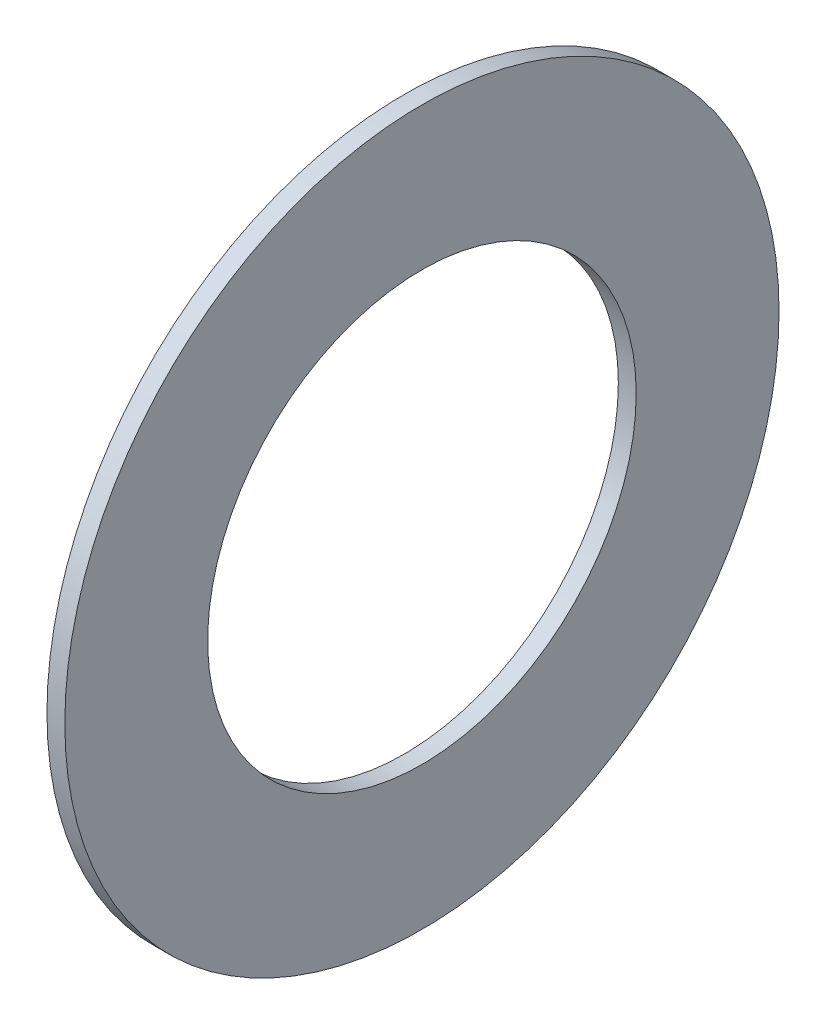
from build123d import *

# Parameters (mm, degrees)
SKETCH1_R      = 15.875
SKETCH1_R_2    = 9.525
EXTRUDE1_DEPTH = 0.79375


with BuildPart() as part:
    # Sketch1 → Extrude1 (new body)
    with BuildSketch(Plane(origin=(0, 0, 0), x_dir=(0, 0, -1), z_dir=(1, 0, 0))):
        Circle(SKETCH1_R)
        Circle(SKETCH1_R_2, mode=Mode.SUBTRACT)
    extrude(amount=EXTRUDE1_DEPTH)


solid = part.part
